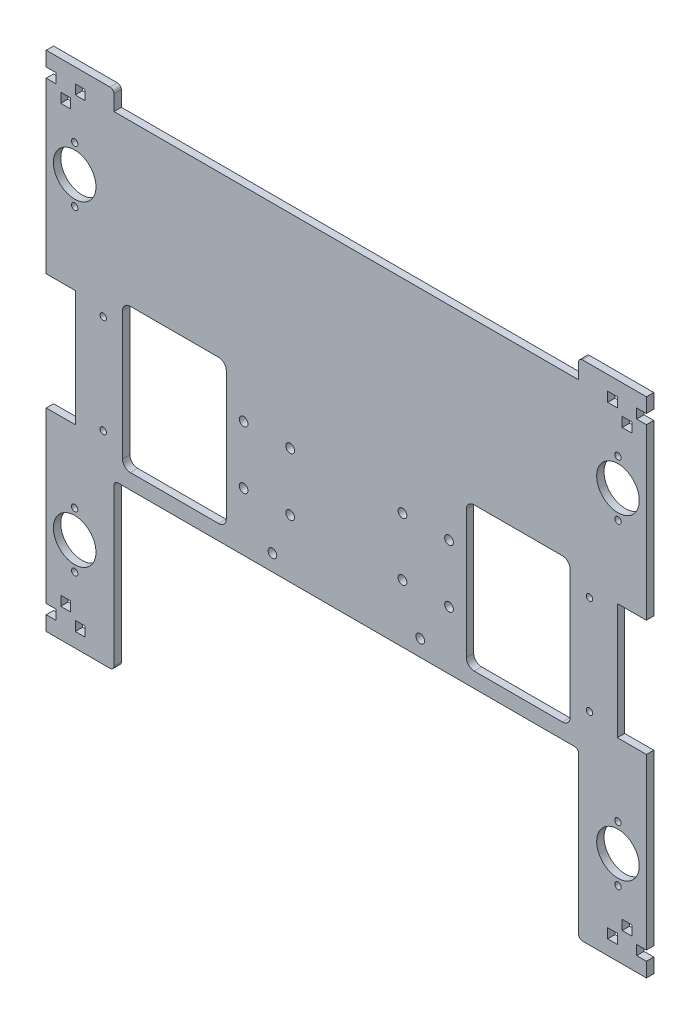
from build123d import *

# Parameters (mm, degrees)
SKETCH2_R           = 1.65
SKETCH2_R_2         = 11
SKETCH2_R_3         = 2.25
SKETCH2_W           = 5
SKETCH2_H           = 5
BOSS_EXTRUDE1_DEPTH = 3.8


with BuildPart() as part:
    # Sketch2 → Boss-Extrude1 (new body)
    with BuildSketch(Plane.XY):
        with BuildLine():
            Line((-155, 155), (-122, 155))
            ThreePointArc((-122, 155), (-120.585786438, 154.414213562), (-120, 153))
            Line((-120, 153), (-120, 145.072545974))
            Line((-120, 145.072545974), (120, 145.072545974))
            Line((120, 145.072545974), (120, 153))
            ThreePointArc((120, 153), (120.585786438, 154.414213562), (122, 155))
            Line((122, 155), (155, 155))
            Line((155, 155), (155, 147.5))
            Line((155, 147.5), (150, 147.5))
            Line((150, 147.5), (150, 142.5))
            Line((150, 142.5), (155, 142.5))
            Line((155, 142.5), (155, 55))
            Line((155, 55), (140, 55))
            Line((140, 55), (140, -5))
            Line((140, -5), (155, -5))
            Line((155, -5), (155, -92.5))
            Line((155, -92.5), (150, -92.5))
            Line((150, -92.5), (150, -97.5))
            Line((150, -97.5), (155, -97.5))
            Line((155, -97.5), (155, -105))
            Line((155, -105), (122, -105))
            ThreePointArc((122, -105), (120.585786438, -104.414213562), (120, -103))
            Line((120, -103), (120, -22))
            ThreePointArc((120, -22), (119.414213562, -20.585786438), (118, -20))
            Line((118, -20), (-118, -20))
            ThreePointArc((-118, -20), (-119.414213562, -20.585786438), (-120, -22))
            Line((-120, -22), (-120, -103))
            ThreePointArc((-120, -103), (-120.585786438, -104.414213562), (-122, -105))
            Line((-122, -105), (-155, -105))
            Line((-155, -105), (-155, -97.5))
            Line((-155, -97.5), (-150, -97.5))
            Line((-150, -97.5), (-150, -92.5))
            Line((-150, -92.5), (-155, -92.5))
            Line((-155, -92.5), (-155, -5))
            Line((-155, -5), (-140, -5))
            Line((-140, -5), (-140, 55))
            Line((-140, 55), (-155, 55))
            Line((-155, 55), (-155, 142.5))
            Line((-155, 142.5), (-150, 142.5))
            Line((-150, 142.5), (-150, 147.5))
            Line((-150, 147.5), (-155, 147.5))
            Line((-155, 147.5), (-155, 155))
        make_face()
        with Locations(Location((-140.309773495, 121.076789794, 0), (0, 0, 180))):
            Circle(SKETCH2_R, mode=Mode.SUBTRACT)
        with Locations(Location((-140.309773495, 92.407184142, 0), (0, 0, 180))):
            Circle(SKETCH2_R, mode=Mode.SUBTRACT)
        with Locations(Location((140.309773495, 121.076789794, 0), (0, 0, 180))):
            Circle(SKETCH2_R, mode=Mode.SUBTRACT)
        with Locations(Location((140.309773495, 92.407184142, 0), (0, 0, 180))):
            Circle(SKETCH2_R, mode=Mode.SUBTRACT)
        with Locations(Location((140.309773495, 106.741986968, 0), (0, 0, 180))):
            Circle(SKETCH2_R_2, mode=Mode.SUBTRACT)
        with Locations(Location((-140.309773495, 106.741986968, 0), (0, 0, 180))):
            Circle(SKETCH2_R_2, mode=Mode.SUBTRACT)
        with Locations(Location((125.59774802, -0.5, 0), (0, 0, 180))):
            Circle(SKETCH2_R, mode=Mode.SUBTRACT)
        with Locations(Location((125.59774802, 50.5, 0), (0, 0, 180))):
            Circle(SKETCH2_R, mode=Mode.SUBTRACT)
        with Locations(Location((-125.59774802, -0.5, 0), (0, 0, 180))):
            Circle(SKETCH2_R, mode=Mode.SUBTRACT)
        with Locations(Location((-125.59774802, 50.5, 0), (0, 0, 180))):
            Circle(SKETCH2_R, mode=Mode.SUBTRACT)
        with Locations(Location((-29, 10.055, 0), (0, 0, 180))):
            Circle(SKETCH2_R_3, mode=Mode.SUBTRACT)
        with Locations(Location((-29, 39.945, 0), (0, 0, 180))):
            Circle(SKETCH2_R_3, mode=Mode.SUBTRACT)
        with Locations(Location((-53.06, 39.945, 0), (0, 0, 180))):
            Circle(SKETCH2_R_3, mode=Mode.SUBTRACT)
        with Locations(Location((-53.06, 10.055, 0), (0, 0, 180))):
            Circle(SKETCH2_R_3, mode=Mode.SUBTRACT)
        with Locations(Location((53.06, 10.055, 0), (0, 0, 180))):
            Circle(SKETCH2_R_3, mode=Mode.SUBTRACT)
        with Locations(Location((29, 10.055, 0), (0, 0, 180))):
            Circle(SKETCH2_R_3, mode=Mode.SUBTRACT)
        with Locations(Location((29, 39.945, 0), (0, 0, 180))):
            Circle(SKETCH2_R_3, mode=Mode.SUBTRACT)
        with Locations(Location((53.06, 39.945, 0), (0, 0, 180))):
            Circle(SKETCH2_R_3, mode=Mode.SUBTRACT)
        with Locations(Location((140.309773495, -71.076789794, 0), (0, 0, 180))):
            Circle(SKETCH2_R, mode=Mode.SUBTRACT)
        with Locations(Location((140.309773495, -42.407184142, 0), (0, 0, 180))):
            Circle(SKETCH2_R, mode=Mode.SUBTRACT)
        with Locations(Location((140.309773495, -56.741986968, 0), (0, 0, 180))):
            Circle(SKETCH2_R_2, mode=Mode.SUBTRACT)
        with Locations(Location((-140.309773495, -56.741986968, 0), (0, 0, 180))):
            Circle(SKETCH2_R_2, mode=Mode.SUBTRACT)
        with Locations(Location((-140.309773495, -42.407184142, 0), (0, 0, 180))):
            Circle(SKETCH2_R, mode=Mode.SUBTRACT)
        with Locations(Location((-140.309773495, -71.076789794, 0), (0, 0, 180))):
            Circle(SKETCH2_R, mode=Mode.SUBTRACT)
        with Locations(Location((38.179918963, -11.563765186, 0), (0, 0, 180))):
            Circle(SKETCH2_R_3, mode=Mode.SUBTRACT)
        with Locations(Location((-38.179918963, -11.563765186, 0), (0, 0, 180))):
            Circle(SKETCH2_R_3, mode=Mode.SUBTRACT)
        with BuildLine():
            Line((-66, 62.171403079), (-111.59774802, 62.171403079))
            ThreePointArc((-111.59774802, 62.171403079), (-114.426175145, 60.999830204), (-115.59774802, 58.171403079))
            Line((-115.59774802, 58.171403079), (-115.59774802, -8.171403079))
            ThreePointArc((-115.59774802, -8.171403079), (-114.426175145, -10.999830204), (-111.59774802, -12.171403079))
            Line((-111.59774802, -12.171403079), (-66, -12.171403079))
            ThreePointArc((-66, -12.171403079), (-63.171572875, -10.999830204), (-62, -8.171403079))
            Line((-62, -8.171403079), (-62, 58.171403079))
            ThreePointArc((-62, 58.171403079), (-63.171572875, 60.999830204), (-66, 62.171403079))
        make_face(mode=Mode.SUBTRACT)
        with BuildLine():
            Line((66, 62.171403079), (111.59774802, 62.171403079))
            ThreePointArc((111.59774802, 62.171403079), (114.426175145, 60.999830204), (115.59774802, 58.171403079))
            Line((115.59774802, 58.171403079), (115.59774802, -8.171403079))
            ThreePointArc((115.59774802, -8.171403079), (114.426175145, -10.999830204), (111.59774802, -12.171403079))
            Line((111.59774802, -12.171403079), (66, -12.171403079))
            ThreePointArc((66, -12.171403079), (63.171572875, -10.999830204), (62, -8.171403079))
            Line((62, -8.171403079), (62, 58.171403079))
            ThreePointArc((62, 58.171403079), (63.171572875, 60.999830204), (66, 62.171403079))
        make_face(mode=Mode.SUBTRACT)
        with Locations((-145, -87.5)):
            Rectangle(SKETCH2_W, SKETCH2_H, mode=Mode.SUBTRACT)
        with Locations((-137.5, -95)):
            Rectangle(SKETCH2_W, SKETCH2_H, mode=Mode.SUBTRACT)
        with Locations((137.5, -95)):
            Rectangle(SKETCH2_W, SKETCH2_H, mode=Mode.SUBTRACT)
        with Locations((145, -87.5)):
            Rectangle(SKETCH2_W, SKETCH2_H, mode=Mode.SUBTRACT)
        with Locations((-137.5, 145)):
            Rectangle(SKETCH2_W, SKETCH2_H, mode=Mode.SUBTRACT)
        with Locations((-145, 137.5)):
            Rectangle(SKETCH2_W, SKETCH2_H, mode=Mode.SUBTRACT)
        with Locations((145, 137.5)):
            Rectangle(SKETCH2_W, SKETCH2_H, mode=Mode.SUBTRACT)
        with Locations((137.5, 145)):
            Rectangle(SKETCH2_W, SKETCH2_H, mode=Mode.SUBTRACT)
    extrude(amount=BOSS_EXTRUDE1_DEPTH)


solid = part.part
